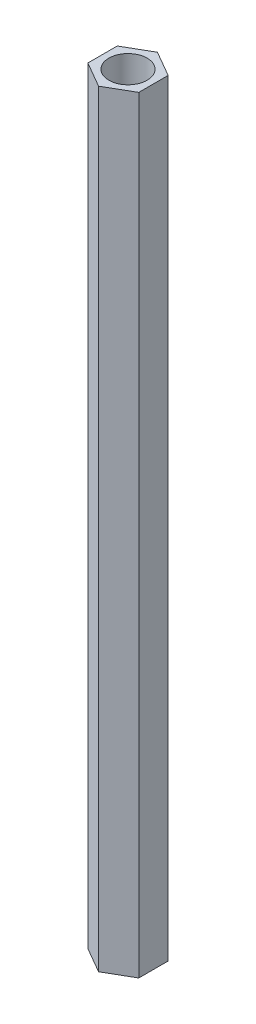
from build123d import *

# Parameters (mm, degrees)
SKETCH_1_R      = 1.5
EXTRUDE_1_DEPTH = 60


with BuildPart() as part:
    # 草图1 → 凸台-拉伸1 (new body)
    with BuildSketch(Plane(origin=(0, 0, 0), x_dir=(1, 0, 0), z_dir=(0, 1, 0))):
        Polygon((0, 2.3), (-1.991858429, 1.15), (-1.991858429, -1.15), (0, -2.3), (1.991858429, -1.15), (1.991858429, 1.15), align=None)
        with Locations(Location((0, 0, 0), (0, 0, 270))):
            Circle(SKETCH_1_R, mode=Mode.SUBTRACT)
    extrude(amount=EXTRUDE_1_DEPTH)


solid = part.part
